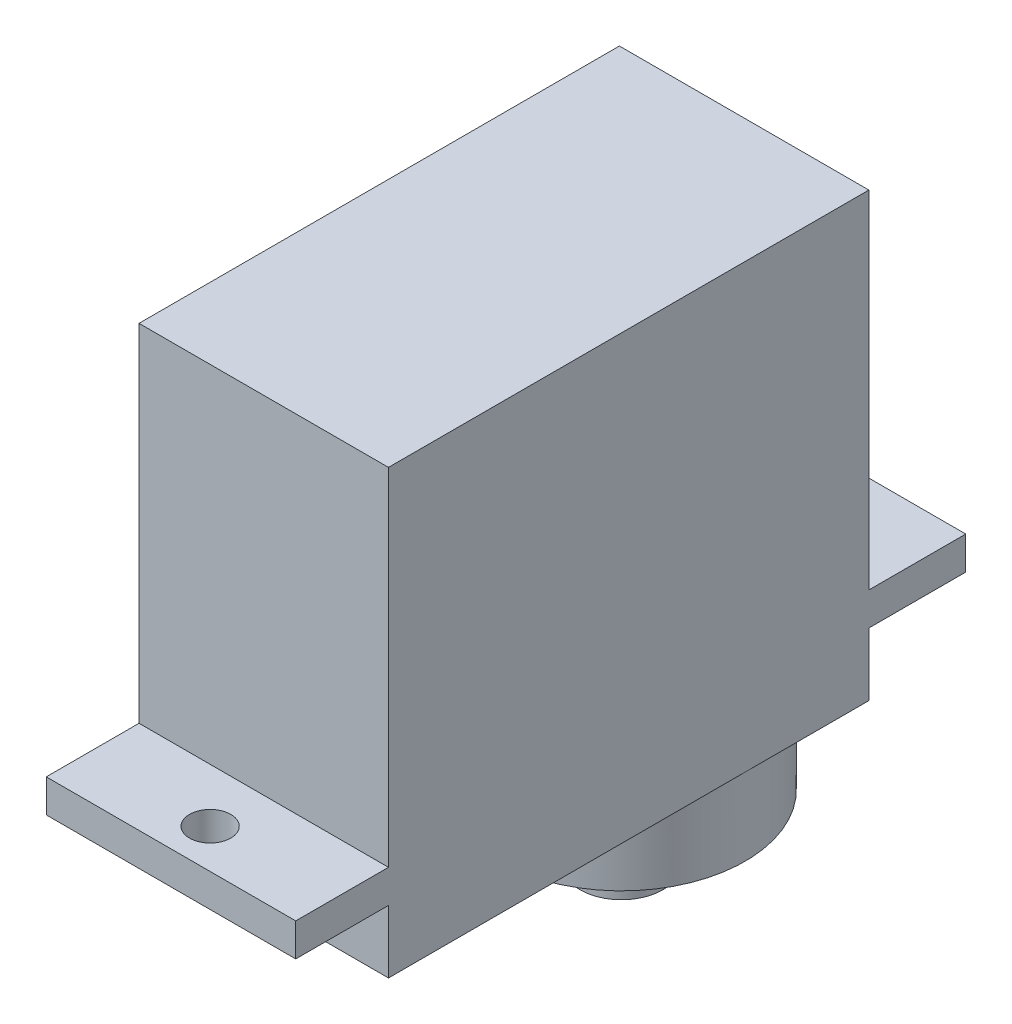
from build123d import *

# Parameters (mm, degrees)
SKETCH_3_W          = 32.5
SKETCH_3_H          = 21.45
EXTRUDE_1_DEPTH     = 6.05
CUT_EXTRUDE_START   = -3.86581
SKETCH_4_W          = 12.1
SKETCH_4_H          = 4.7
SKETCH_4_H_2        = 4.6
CUT_EXTRUDE_1_DEPTH = 26.951221363
CUT_EXTRUDE_START_2 = -5.46581
SKETCH_4_2_W        = 12.1
SKETCH_4_2_H        = 4.7
SKETCH_4_2_H_2      = 4.6
CUT_EXTRUDE_2_DEPTH = 17.619601363
SKETCH_5_R          = 1
CUT_EXTRUDE_3_DEPTH = 23.085411363
EXTRUDE_START       = -8.5159
SKETCH_6_R          = 6.000000077
SKETCH_6_R_2        = 1.25
EXTRUDE_2_DEPTH     = 3.7991
EXTRUDE_START_2     = -12.3159
SKETCH_6_6_R        = 1.999999968
EXTRUDE_3_DEPTH     = 3.2
SKETCH_6_7_R        = 1.25
CUT_EXTRUDE_4_DEPTH = 24.690031766


with BuildPart() as part:
    # 草图3 → 凸台-拉伸1 (new, symmetric)
    with BuildSketch(Plane(origin=(0, 0, 0), x_dir=(0, 0, -1), z_dir=(1, 0, 0))):
        with Locations((-0.5985, 2.2091)):
            Rectangle(SKETCH_3_W, SKETCH_3_H)
    extrude(amount=EXTRUDE_1_DEPTH, both=True)

    # 草图4 → 切除-拉伸1 (cut, through all)
    with BuildSketch(Plane(origin=(0, 0, 0), x_dir=(1, 0, 0), z_dir=(0, 1, 0)).offset(CUT_EXTRUDE_START)):
        with Locations((0, 13.30155)):
            Rectangle(SKETCH_4_W, SKETCH_4_H)
        with Locations((0, -14.6484)):
            Rectangle(SKETCH_4_W, SKETCH_4_H_2)
    extrude(amount=CUT_EXTRUDE_1_DEPTH, mode=Mode.SUBTRACT)

    # 草图4<2> → 切除-拉伸2 (cut, through all)
    with BuildSketch(Plane(origin=(0, 0, 0), x_dir=(1, 0, 0), z_dir=(0, 1, 0)).offset(CUT_EXTRUDE_START_2)):
        with Locations((0, 13.30155)):
            Rectangle(SKETCH_4_2_W, SKETCH_4_2_H)
        with Locations((0, -14.6484)):
            Rectangle(SKETCH_4_2_W, SKETCH_4_2_H_2)
    extrude(amount=-CUT_EXTRUDE_2_DEPTH, mode=Mode.SUBTRACT)

    # 草图5 → 切除-拉伸3 (cut, through all)
    with BuildSketch(Plane(origin=(0, 0, 0), x_dir=(1, 0, 0), z_dir=(0, 1, 0))):
        with Locations((0, 13.55)):
            Circle(SKETCH_5_R)
        with Locations((0, -14.949238683)):
            Circle(SKETCH_5_R)
    extrude(amount=-CUT_EXTRUDE_3_DEPTH, mode=Mode.SUBTRACT)

    # 草图6 → 凸台-拉伸2 (add)
    with BuildSketch(Plane(origin=(0, 0, 0), x_dir=(1, 0, 0), z_dir=(0, 1, 0)).offset(EXTRUDE_START)):
        with Locations((4.63e-07, 5.001545165)):
            Circle(SKETCH_6_R)
        with Locations((4.63e-07, 5.001545165)):
            Circle(SKETCH_6_R_2, mode=Mode.SUBTRACT)
    extrude(amount=-EXTRUDE_2_DEPTH)


with BuildPart() as body_2:
    # 草图6<6> → 凸台-拉伸3 (new body)
    with BuildSketch(Plane(origin=(0, 0, 0), x_dir=(1, 0, 0), z_dir=(0, 1, 0)).offset(EXTRUDE_START_2)):
        with Locations((4.63e-07, 5.001545165)):
            Circle(SKETCH_6_6_R)
    extrude(amount=-EXTRUDE_3_DEPTH)


with BuildPart() as cut_extrude_4_tool:
    # 草图6<7> → 切除-拉伸4 (new, through all)
    with BuildSketch(Plane(origin=(0, 0, 0), x_dir=(1, 0, 0), z_dir=(0, 1, 0))):
        with Locations((4.63e-07, 5.001545165)):
            Circle(SKETCH_6_7_R)
    extrude(amount=-CUT_EXTRUDE_4_DEPTH)


with BuildPart() as part_1:
    add(part.part)

    # 切除-拉伸4: cut by cut_extrude_4_tool
    add(cut_extrude_4_tool.part, mode=Mode.SUBTRACT)


with BuildPart() as body_2_1:
    add(body_2.part)

    # 切除-拉伸4: cut by cut_extrude_4_tool
    add(cut_extrude_4_tool.part, mode=Mode.SUBTRACT)


solid = Compound([part_1.part, body_2_1.part])
